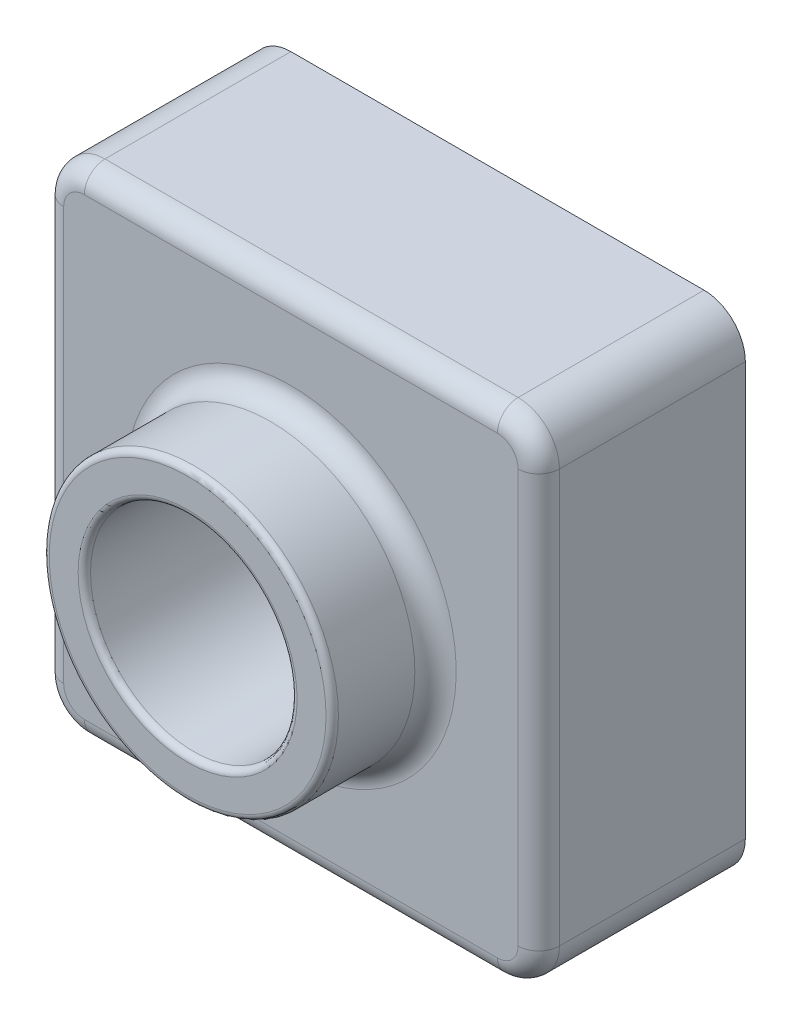
from build123d import *

# Parameters (mm, degrees)
SKETCH2_W           = 120
SKETCH2_H           = 120
BOSS_EXTRUDE1_DEPTH = 50
SKETCH3_R           = 35
BOSS_EXTRUDE2_DEPTH = 25
SKETCH4_R           = 25
CUT_EXTRUDE3_DEPTH  = 186.539753153
FILLET1_R           = 10
FILLET3_R           = 1.5
FILLET5_R           = 5
SHELL1_T            = -2


with BuildPart() as part:
    # Sketch2 → Boss-Extrude1 (new body)
    with BuildSketch(Plane.XY):
        with Locations((60, 60)):
            Rectangle(SKETCH2_W, SKETCH2_H)
    extrude(amount=BOSS_EXTRUDE1_DEPTH)

    # Sketch3 → Boss-Extrude2 (add)
    with BuildSketch(Plane.XY.offset(50)):
        with Locations(Location((60, 60, 0), (0, 0, 180))):
            Circle(SKETCH3_R)
    extrude(amount=BOSS_EXTRUDE2_DEPTH)

    # Sketch4 → Cut-Extrude3 (cut, through all)
    with BuildSketch(Plane.XY.offset(75)):
        with Locations((60, 60)):
            Circle(SKETCH4_R)
    extrude(amount=-CUT_EXTRUDE3_DEPTH, mode=Mode.SUBTRACT)

    # Fillet1
    fillet1_edges = [part.edges().sort_by_distance(p)[0] for p in [
        (0, 0, 25),
        (120, 0, 25),
        (120, 120, 25),
        (0, 120, 25),
    ]]
    fillet(fillet1_edges, radius=FILLET1_R)

    # Fillet3
    fillet3_edges = [part.edges().sort_by_distance(p)[0] for p in [
        (95, 60, 75),
        (35, 60, 75),
    ]]
    fillet(fillet3_edges, radius=FILLET3_R)

    # Fillet5
    fillet5_edges = [part.edges().sort_by_distance(p)[0] for p in [
        (95, 60, 50),
        (120, 60, 50),
        (60, 0, 50),
        (0, 60, 50),
        (60, 120, 50),
        (117.071067812, 117.071067812, 50),
        (2.928932188, 117.071067812, 50),
        (2.928932188, 2.928932188, 50),
        (117.071067812, 2.928932188, 50),
    ]]
    fillet(fillet5_edges, radius=FILLET5_R)

    # Shell1
    shell1_openings = [part.faces().sort_by_distance(p)[0] for p in [
        (60, 1.697056275, 0),
    ]]
    offset(amount=SHELL1_T, openings=shell1_openings, kind=Kind.INTERSECTION)


solid = part.part
